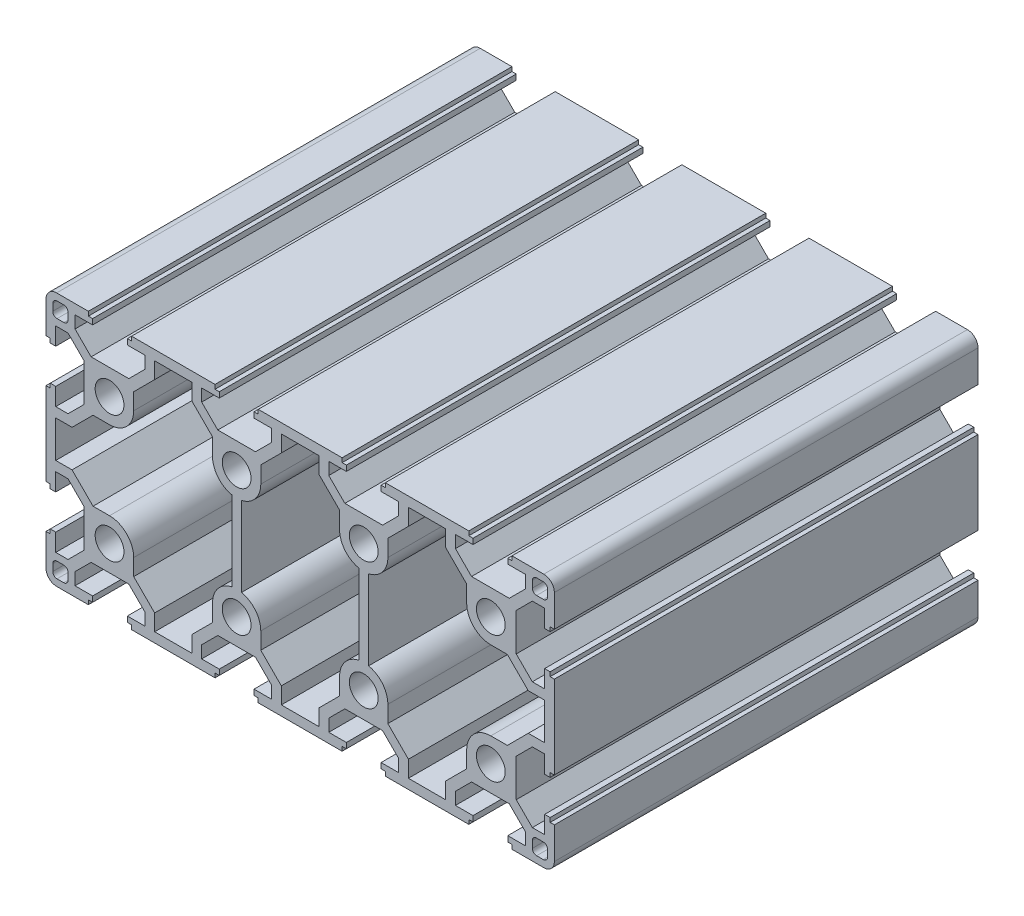
from build123d import *

# Parameters (mm, degrees)
SKETCH_1_R      = 3.4
EXTRUDE_1_DEPTH = 100


with BuildPart() as part:
    # 草图1 → 凸台-拉伸1 (new body)
    with BuildSketch(Plane.XY):
        with BuildLine():
            Line((35.1, 45), (35.1, 44))
            Line((35.1, 44), (34.1, 44))
            Line((34.1, 44), (34.1, 42.7))
            Line((34.1, 42.7), (38.25, 42.7))
            Line((38.25, 42.7), (38.25, 39.8))
            Line((38.25, 39.8), (34.45, 36))
            Line((34.45, 36), (25.55, 36))
            Line((25.55, 36), (21.75, 39.8))
            Line((21.75, 39.8), (21.75, 42.7))
            Line((21.75, 42.7), (25.9, 42.7))
            Line((25.9, 42.7), (25.9, 44))
            Line((25.9, 44), (24.9, 44))
            Line((24.9, 44), (24.9, 45))
            Line((24.9, 45), (5.2, 45))
            Line((5.2, 45), (5.2, 44))
            Line((5.2, 44), (4.2, 44))
            Line((4.2, 44), (4.2, 42.7))
            Line((4.2, 42.7), (8.35, 42.7))
            Line((8.35, 42.7), (8.35, 39.8))
            Line((8.35, 39.8), (4.55, 36))
            Line((4.55, 36), (-4.35, 36))
            Line((-4.35, 36), (-8.15, 39.8))
            Line((-8.15, 39.8), (-8.15, 42.7))
            Line((-8.15, 42.7), (-4, 42.7))
            Line((-4, 42.7), (-4, 44))
            Line((-4, 44), (-5, 44))
            Line((-5, 44), (-5, 45))
            Line((-5, 45), (-12.5, 45))
            ThreePointArc((-12.5, 45), (-14.267766953, 44.267766953), (-15, 42.5))
            Line((-15, 42.5), (-15, 35))
            Line((-15, 35), (-14, 35))
            Line((-14, 35), (-14, 34))
            Line((-14, 34), (-12.7, 34))
            Line((-12.7, 34), (-12.7, 38.15))
            Line((-12.7, 38.15), (-9.8, 38.15))
            Line((-9.8, 38.15), (-6, 34.35))
            Line((-6, 34.35), (-6, 25.45))
            Line((-6, 25.45), (-9.8, 21.65))
            Line((-9.8, 21.65), (-12.7, 21.65))
            Line((-12.7, 21.65), (-12.7, 25.8))
            Line((-12.7, 25.8), (-14, 25.8))
            Line((-14, 25.8), (-14, 24.8))
            Line((-14, 24.8), (-15, 24.8))
            Line((-15, 24.8), (-15, 5.2))
            Line((-15, 5.2), (-14, 5.2))
            Line((-14, 5.2), (-14, 4.2))
            Line((-14, 4.2), (-12.7, 4.2))
            Line((-12.7, 4.2), (-12.7, 8.35))
            Line((-12.7, 8.35), (-9.8, 8.35))
            Line((-9.8, 8.35), (-6, 4.55))
            Line((-6, 4.55), (-6, -4.35))
            Line((-6, -4.35), (-9.8, -8.15))
            Line((-9.8, -8.15), (-12.7, -8.15))
            Line((-12.7, -8.15), (-12.7, -4))
            Line((-12.7, -4), (-14, -4))
            Line((-14, -4), (-14, -5))
            Line((-14, -5), (-15, -5))
            Line((-15, -5), (-15, -12.5))
            ThreePointArc((-15, -12.5), (-14.267766953, -14.267766953), (-12.5, -15))
            Line((-12.5, -15), (-5, -15))
            Line((-5, -15), (-5, -14))
            Line((-5, -14), (-4, -14))
            Line((-4, -14), (-4, -12.7))
            Line((-4, -12.7), (-8.15, -12.7))
            Line((-8.15, -12.7), (-8.15, -9.8))
            Line((-8.15, -9.8), (-4.35, -6))
            Line((-4.35, -6), (4.55, -6))
            Line((4.55, -6), (8.35, -9.8))
            Line((8.35, -9.8), (8.35, -12.7))
            Line((8.35, -12.7), (4.2, -12.7))
            Line((4.2, -12.7), (4.2, -14))
            Line((4.2, -14), (5.2, -14))
            Line((5.2, -14), (5.2, -15))
            Line((5.2, -15), (24.9, -15))
            Line((24.9, -15), (24.9, -14))
            Line((24.9, -14), (25.9, -14))
            Line((25.9, -14), (25.9, -12.7))
            Line((25.9, -12.7), (21.75, -12.7))
            Line((21.75, -12.7), (21.75, -9.8))
            Line((21.75, -9.8), (25.55, -6))
            Line((25.55, -6), (34.45, -6))
            Line((34.45, -6), (38.25, -9.8))
            Line((38.25, -9.8), (38.25, -12.7))
            Line((38.25, -12.7), (34.1, -12.7))
            Line((34.1, -12.7), (34.1, -14))
            Line((34.1, -14), (35.1, -14))
            Line((35.1, -14), (35.1, -15))
            Line((35.1, -15), (54.9, -15))
            Line((54.9, -15), (54.9, -14))
            Line((54.9, -14), (55.9, -14))
            Line((55.9, -14), (55.9, -12.7))
            Line((55.9, -12.7), (51.75, -12.7))
            Line((51.75, -12.7), (51.75, -9.8))
            Line((51.75, -9.8), (55.55, -6))
            Line((55.55, -6), (64.45, -6))
            Line((64.45, -6), (68.25, -9.8))
            Line((68.25, -9.8), (68.25, -12.7))
            Line((68.25, -12.7), (64.1, -12.7))
            Line((64.1, -12.7), (64.1, -14))
            Line((64.1, -14), (65.1, -14))
            Line((65.1, -14), (65.1, -15))
            Line((65.1, -15), (84.8, -15))
            Line((84.8, -15), (84.8, -14))
            Line((84.8, -14), (85.8, -14))
            Line((85.8, -14), (85.8, -12.7))
            Line((85.8, -12.7), (81.65, -12.7))
            Line((81.65, -12.7), (81.65, -9.8))
            Line((81.65, -9.8), (85.45, -6))
            Line((85.45, -6), (94.35, -6))
            Line((94.35, -6), (98.15, -9.8))
            Line((98.15, -9.8), (98.15, -12.7))
            Line((98.15, -12.7), (94, -12.7))
            Line((94, -12.7), (94, -14))
            Line((94, -14), (95, -14))
            Line((95, -14), (95, -15))
            Line((95, -15), (102.5, -15))
            ThreePointArc((102.5, -15), (104.267766953, -14.267766953), (105, -12.5))
            Line((105, -12.5), (105, -5))
            Line((105, -5), (104, -5))
            Line((104, -5), (104, -4))
            Line((104, -4), (102.7, -4))
            Line((102.7, -4), (102.7, -8.15))
            Line((102.7, -8.15), (99.8, -8.15))
            Line((99.8, -8.15), (96, -4.35))
            Line((96, -4.35), (96, 4.55))
            Line((96, 4.55), (99.8, 8.35))
            Line((99.8, 8.35), (102.7, 8.35))
            Line((102.7, 8.35), (102.7, 4.2))
            Line((102.7, 4.2), (104, 4.2))
            Line((104, 4.2), (104, 5.2))
            Line((104, 5.2), (105, 5.2))
            Line((105, 5.2), (105, 24.8))
            Line((105, 24.8), (104, 24.8))
            Line((104, 24.8), (104, 25.8))
            Line((104, 25.8), (102.7, 25.8))
            Line((102.7, 25.8), (102.7, 21.65))
            Line((102.7, 21.65), (99.8, 21.65))
            Line((99.8, 21.65), (96, 25.45))
            Line((96, 25.45), (96, 34.35))
            Line((96, 34.35), (99.8, 38.15))
            Line((99.8, 38.15), (102.7, 38.15))
            Line((102.7, 38.15), (102.7, 34))
            Line((102.7, 34), (104, 34))
            Line((104, 34), (104, 35))
            Line((104, 35), (105, 35))
            Line((105, 35), (105, 42.5))
            ThreePointArc((105, 42.5), (104.267766953, 44.267766953), (102.5, 45))
            Line((102.5, 45), (95, 45))
            Line((95, 45), (95, 44))
            Line((95, 44), (94, 44))
            Line((94, 44), (94, 42.8))
            Line((94, 42.8), (98.15, 42.8))
            Line((98.15, 42.8), (98.15, 39.8))
            Line((98.15, 39.8), (94.35, 36))
            Line((94.35, 36), (85.45, 36))
            Line((85.45, 36), (81.65, 39.8))
            Line((81.65, 39.8), (81.65, 42.7))
            Line((81.65, 42.7), (85.8, 42.7))
            Line((85.8, 42.7), (85.8, 44))
            Line((85.8, 44), (84.8, 44))
            Line((84.8, 44), (84.8, 45))
            Line((84.8, 45), (65.1, 45))
            Line((65.1, 45), (65.1, 44))
            Line((65.1, 44), (64.1, 44))
            Line((64.1, 44), (64.1, 42.7))
            Line((64.1, 42.7), (68.25, 42.7))
            Line((68.25, 42.7), (68.25, 39.8))
            Line((68.25, 39.8), (64.45, 36))
            Line((64.45, 36), (55.55, 36))
            Line((55.55, 36), (51.75, 39.8))
            Line((51.75, 39.8), (51.75, 42.7))
            Line((51.75, 42.7), (55.9, 42.7))
            Line((55.9, 42.7), (55.9, 44))
            Line((55.9, 44), (54.9, 44))
            Line((54.9, 44), (54.9, 45))
            Line((54.9, 45), (35.1, 45))
        make_face()
        with Locations((0, 30)):
            Circle(SKETCH_1_R, mode=Mode.SUBTRACT)
        Circle(SKETCH_1_R, mode=Mode.SUBTRACT)
        with Locations((30, 0)):
            Circle(SKETCH_1_R, mode=Mode.SUBTRACT)
        with Locations((30, 30)):
            Circle(SKETCH_1_R, mode=Mode.SUBTRACT)
        with Locations((60, 30)):
            Circle(SKETCH_1_R, mode=Mode.SUBTRACT)
        with Locations((60, 0)):
            Circle(SKETCH_1_R, mode=Mode.SUBTRACT)
        with Locations((90, 0)):
            Circle(SKETCH_1_R, mode=Mode.SUBTRACT)
        with Locations((90, 30)):
            Circle(SKETCH_1_R, mode=Mode.SUBTRACT)
        with BuildLine():
            Line((-10.8, 39.8), (-12.4, 39.8))
            ThreePointArc((-12.4, 39.8), (-13.107106781, 40.092893219), (-13.4, 40.8))
            Line((-13.4, 40.8), (-13.4, 42.4))
            ThreePointArc((-13.4, 42.4), (-13.107106781, 43.107106781), (-12.4, 43.4))
            Line((-12.4, 43.4), (-10.8, 43.4))
            ThreePointArc((-10.8, 43.4), (-10.092893219, 43.107106781), (-9.8, 42.4))
            Line((-9.8, 42.4), (-9.8, 40.8))
            ThreePointArc((-9.8, 40.8), (-10.092893219, 40.092893219), (-10.8, 39.8))
        make_face(mode=Mode.SUBTRACT)
        with BuildLine():
            Line((-9.8, -10.8), (-9.8, -12.4))
            ThreePointArc((-9.8, -12.4), (-10.092893219, -13.107106781), (-10.8, -13.4))
            Line((-10.8, -13.4), (-12.4, -13.4))
            ThreePointArc((-12.4, -13.4), (-13.107106781, -13.107106781), (-13.4, -12.4))
            Line((-13.4, -12.4), (-13.4, -10.8))
            ThreePointArc((-13.4, -10.8), (-13.107106781, -10.092893219), (-12.4, -9.8))
            Line((-12.4, -9.8), (-10.8, -9.8))
            ThreePointArc((-10.8, -9.8), (-10.092893219, -10.092893219), (-9.8, -10.8))
        make_face(mode=Mode.SUBTRACT)
        with BuildLine():
            Line((-3.897308807, 5.7), (-8.847308807, 10.65))
            Line((-8.847308807, 10.65), (-12.7, 10.65))
            Line((-12.7, 10.65), (-12.7, 19.35))
            Line((-12.7, 19.35), (-8.847308807, 19.35))
            Line((-8.847308807, 19.35), (-3.897308807, 24.3))
            Line((-3.897308807, 24.3), (0, 24.3))
            ThreePointArc((0, 24.3), (4.030508653, 25.969491347), (5.7, 30))
            Line((5.7, 30), (5.7, 33.897308807))
            Line((5.7, 33.897308807), (10.65, 38.847308807))
            Line((10.65, 38.847308807), (10.65, 42.7))
            Line((10.65, 42.7), (19.45, 42.7))
            Line((19.45, 42.7), (19.45, 38.847308807))
            Line((19.45, 38.847308807), (24.3, 33.997308807))
            Line((24.3, 33.997308807), (24.3, 30))
            ThreePointArc((24.3, 30), (25.581572678, 26.398958484), (28.85, 24.417213957))
            Line((28.85, 24.417213957), (28.85, 5.582786043))
            ThreePointArc((28.85, 5.582786043), (25.581572678, 3.601041516), (24.3, 0))
            Line((24.3, 0), (24.3, -3.997308807))
            Line((24.3, -3.997308807), (19.45, -8.847308807))
            Line((19.45, -8.847308807), (19.45, -12.7))
            Line((19.45, -12.7), (10.65, -12.7))
            Line((10.65, -12.7), (10.65, -8.847308807))
            Line((10.65, -8.847308807), (5.7, -3.897308807))
            Line((5.7, -3.897308807), (5.7, 0))
            ThreePointArc((5.7, 0), (4.030508653, 4.030508653), (0, 5.7))
            Line((0, 5.7), (-3.897308807, 5.7))
        make_face(mode=Mode.SUBTRACT)
        with BuildLine():
            Line((35.7, -3.95), (35.7, 0))
            ThreePointArc((35.7, 0), (34.418427322, 3.601041516), (31.15, 5.582786043))
            Line((31.15, 5.582786043), (31.15, 24.417213957))
            ThreePointArc((31.15, 24.417213957), (34.418427322, 26.398958484), (35.7, 30))
            Line((35.7, 30), (35.7, 33.95))
            Line((35.7, 33.95), (40.55, 38.8))
            Line((40.55, 38.8), (40.55, 42.7))
            Line((40.55, 42.7), (49.45, 42.7))
            Line((49.45, 42.7), (49.45, 38.847308807))
            Line((49.45, 38.847308807), (54.3, 33.997308807))
            Line((54.3, 33.997308807), (54.3, 30))
            ThreePointArc((54.3, 30), (55.581572678, 26.398958484), (58.85, 24.417213957))
            Line((58.85, 24.417213957), (58.85, 5.582786043))
            ThreePointArc((58.85, 5.582786043), (55.581572678, 3.601041516), (54.3, 0))
            Line((54.3, 0), (54.3, -3.997308807))
            Line((54.3, -3.997308807), (49.45, -8.847308807))
            Line((49.45, -8.847308807), (49.45, -12.7))
            Line((49.45, -12.7), (40.55, -12.7))
            Line((40.55, -12.7), (40.55, -8.8))
            Line((40.55, -8.8), (35.7, -3.95))
        make_face(mode=Mode.SUBTRACT)
        with BuildLine():
            Line((100.8, -9.8), (102.4, -9.8))
            ThreePointArc((102.4, -9.8), (103.107106781, -10.092893219), (103.4, -10.8))
            Line((103.4, -10.8), (103.4, -12.4))
            ThreePointArc((103.4, -12.4), (103.107106781, -13.107106781), (102.4, -13.4))
            Line((102.4, -13.4), (100.8, -13.4))
            ThreePointArc((100.8, -13.4), (100.092893219, -13.107106781), (99.8, -12.4))
            Line((99.8, -12.4), (99.8, -10.8))
            ThreePointArc((99.8, -10.8), (100.092893219, -10.092893219), (100.8, -9.8))
        make_face(mode=Mode.SUBTRACT)
        with BuildLine():
            Line((84.3, 0), (84.3, -3.897308807))
            Line((84.3, -3.897308807), (79.35, -8.847308807))
            Line((79.35, -8.847308807), (79.35, -12.7))
            Line((79.35, -12.7), (70.55, -12.7))
            Line((70.55, -12.7), (70.55, -8.8))
            Line((70.55, -8.8), (65.7, -3.95))
            Line((65.7, -3.95), (65.7, 0))
            ThreePointArc((65.7, 0), (64.418427322, 3.601041516), (61.15, 5.582786043))
            Line((61.15, 5.582786043), (61.15, 24.417213957))
            ThreePointArc((61.15, 24.417213957), (64.418427322, 26.398958484), (65.7, 30))
            Line((65.7, 30), (65.7, 33.95))
            Line((65.7, 33.95), (70.55, 38.8))
            Line((70.55, 38.8), (70.55, 42.7))
            Line((70.55, 42.7), (79.35, 42.7))
            Line((79.35, 42.7), (79.35, 38.847308807))
            Line((79.35, 38.847308807), (84.3, 33.897308807))
            Line((84.3, 33.897308807), (84.3, 30))
            ThreePointArc((84.3, 30), (85.969491347, 25.969491347), (90, 24.3))
            Line((90, 24.3), (93.897308807, 24.3))
            Line((93.897308807, 24.3), (98.847308807, 19.35))
            Line((98.847308807, 19.35), (102.7, 19.35))
            Line((102.7, 19.35), (102.7, 10.65))
            Line((102.7, 10.65), (98.847308807, 10.65))
            Line((98.847308807, 10.65), (93.897308807, 5.7))
            Line((93.897308807, 5.7), (90, 5.7))
            ThreePointArc((90, 5.7), (85.969491347, 4.030508653), (84.3, 0))
        make_face(mode=Mode.SUBTRACT)
        with BuildLine():
            Line((99.8, 40.8), (99.8, 42.4))
            ThreePointArc((99.8, 42.4), (100.092893219, 43.107106781), (100.8, 43.4))
            Line((100.8, 43.4), (102.4, 43.4))
            ThreePointArc((102.4, 43.4), (103.107106781, 43.107106781), (103.4, 42.4))
            Line((103.4, 42.4), (103.4, 40.8))
            ThreePointArc((103.4, 40.8), (103.107106781, 40.092893219), (102.4, 39.8))
            Line((102.4, 39.8), (100.8, 39.8))
            ThreePointArc((100.8, 39.8), (100.092893219, 40.092893219), (99.8, 40.8))
        make_face(mode=Mode.SUBTRACT)
    extrude(amount=EXTRUDE_1_DEPTH)


solid = part.part
